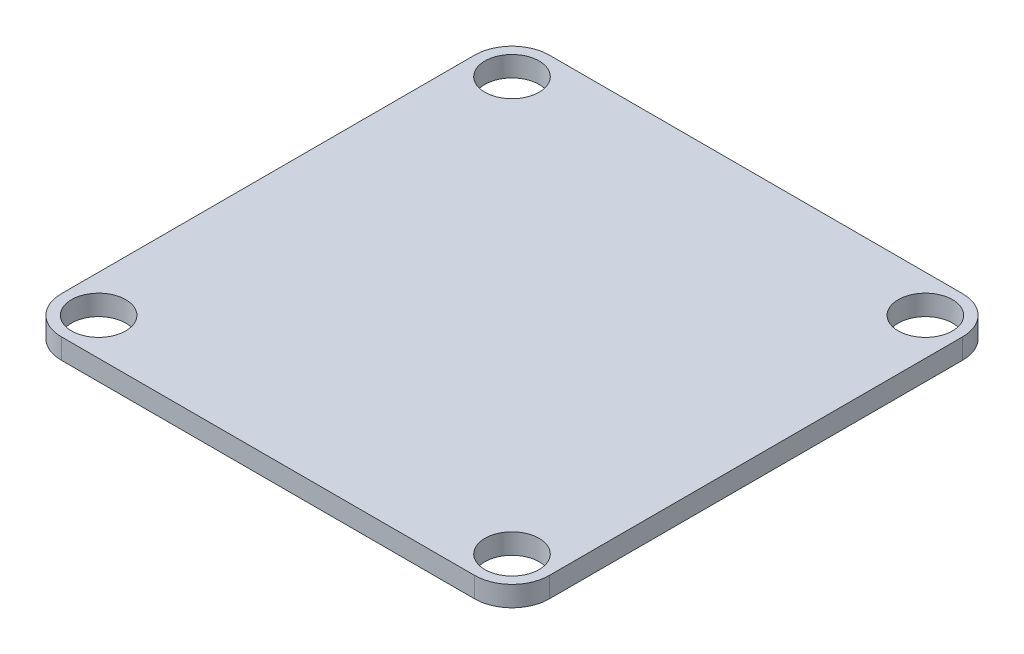
from build123d import *

# Parameters (mm, degrees)
SKETCH_1_R      = 2
EXTRUDE_1_DEPTH = 1.5


with BuildPart() as part:
    # 草图1 → 凸台-拉伸1 (new body)
    with BuildSketch(Plane(origin=(0, 0, 0), x_dir=(1, 0, 0), z_dir=(0, 1, 0))):
        with BuildLine():
            Line((-15.25, -18), (15.25, -18))
            ThreePointArc((15.25, -18), (17.194543648, -17.194543648), (18, -15.25))
            Line((18, -15.25), (18, 15.25))
            ThreePointArc((18, 15.25), (17.194543648, 17.194543648), (15.25, 18))
            Line((15.25, 18), (-15.25, 18))
            ThreePointArc((-15.25, 18), (-17.194543648, 17.194543648), (-18, 15.25))
            Line((-18, 15.25), (-18, -15.25))
            ThreePointArc((-18, -15.25), (-17.194543648, -17.194543648), (-15.25, -18))
        make_face()
        with Locations(Location((15.25, 15.25, 0), (0, 0, 270))):
            Circle(SKETCH_1_R, mode=Mode.SUBTRACT)
        with Locations(Location((15.25, -15.25, 0), (0, 0, 270))):
            Circle(SKETCH_1_R, mode=Mode.SUBTRACT)
        with Locations(Location((-15.25, -15.25, 0), (0, 0, 270))):
            Circle(SKETCH_1_R, mode=Mode.SUBTRACT)
        with Locations(Location((-15.25, 15.25, 0), (0, 0, 270))):
            Circle(SKETCH_1_R, mode=Mode.SUBTRACT)
    extrude(amount=EXTRUDE_1_DEPTH)


solid = part.part
